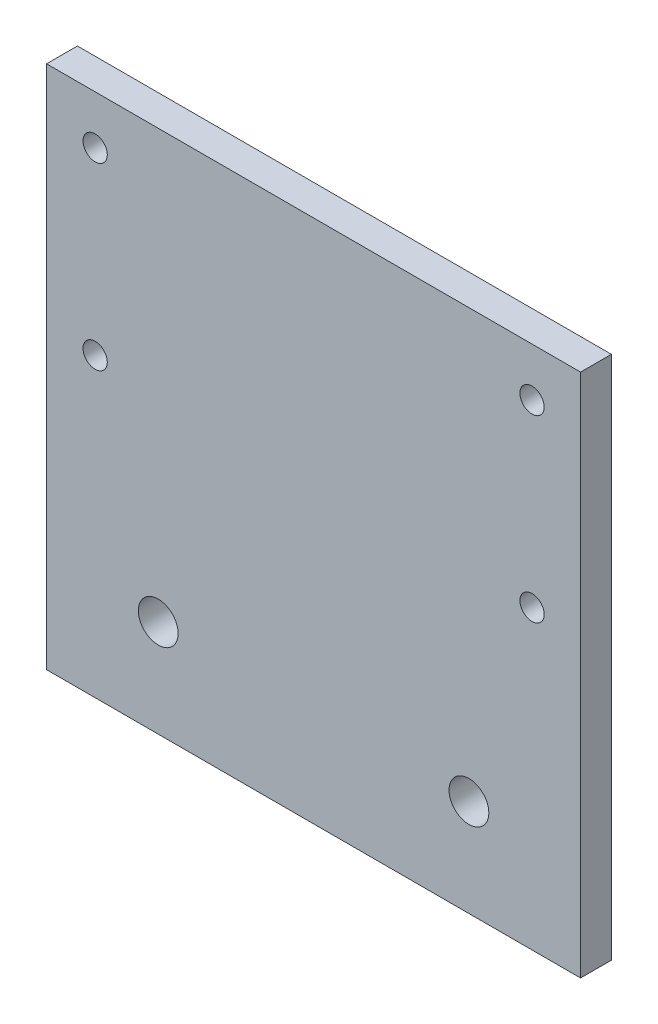
from build123d import *

# Parameters (mm, degrees)
SKETCH1_W           = 55
SKETCH1_H           = 54.05
SKETCH1_R           = 1.25
SKETCH1_R_2         = 2.05
BOSS_EXTRUDE1_DEPTH = 3.175


with BuildPart() as part:
    # Sketch1 → Boss-Extrude1 (new body)
    with BuildSketch(Plane.XY):
        with Locations((27.5, 27.025)):
            Rectangle(SKETCH1_W, SKETCH1_H)
        with Locations((5, 49.05)):
            Circle(SKETCH1_R, mode=Mode.SUBTRACT)
        with Locations((50, 49.05)):
            Circle(SKETCH1_R, mode=Mode.SUBTRACT)
        with Locations((50, 30.55)):
            Circle(SKETCH1_R, mode=Mode.SUBTRACT)
        with Locations((5, 30.55)):
            Circle(SKETCH1_R, mode=Mode.SUBTRACT)
        with Locations((11.5, 10)):
            Circle(SKETCH1_R_2, mode=Mode.SUBTRACT)
        with Locations((43.5, 10)):
            Circle(SKETCH1_R_2, mode=Mode.SUBTRACT)
    extrude(amount=BOSS_EXTRUDE1_DEPTH)


solid = part.part
